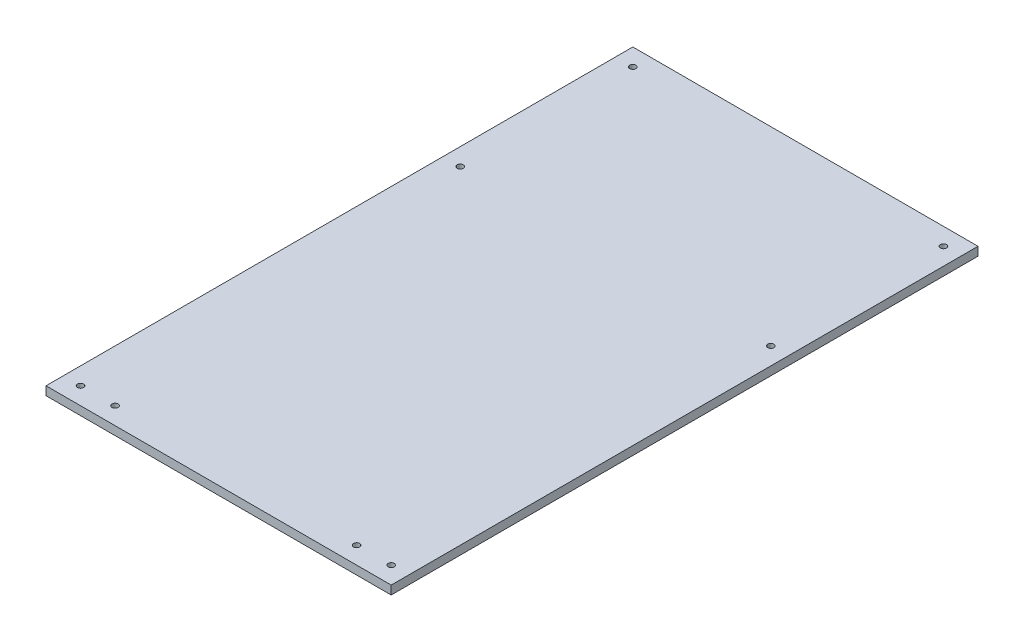
from build123d import *

# Parameters (mm, degrees)
SKETCH1_W                   = 127
SKETCH1_H                   = 215.9
BOSS_EXTRUDE1_DEPTH         = 3.175
F_43_0_089_DIAMETER_HOLE1_D = 2.2606


with BuildPart() as part:
    # Sketch1 → Boss-Extrude1 (new body)
    with BuildSketch(Plane(origin=(0, 0, 0), x_dir=(1, 0, 0), z_dir=(0, 1, 0))):
        with Locations((63.5, 107.95)):
            Rectangle(SKETCH1_W, SKETCH1_H)
    extrude(amount=BOSS_EXTRUDE1_DEPTH)

    # #43 (0.089) Diameter Hole1 (through all)
    with Locations(Plane(origin=(0, 3.175, 0), x_dir=(1, 0, 0), z_dir=(0, 1, 0))):
        with Locations((6.35, 209.55), (120.65, 209.55), (120.65, 146.05), (6.35, 146.05), (120.65, 6.35), (6.35, 6.35), (19.05, 6.35), (107.95, 6.35)):
            Hole(F_43_0_089_DIAMETER_HOLE1_D / 2)


solid = part.part
